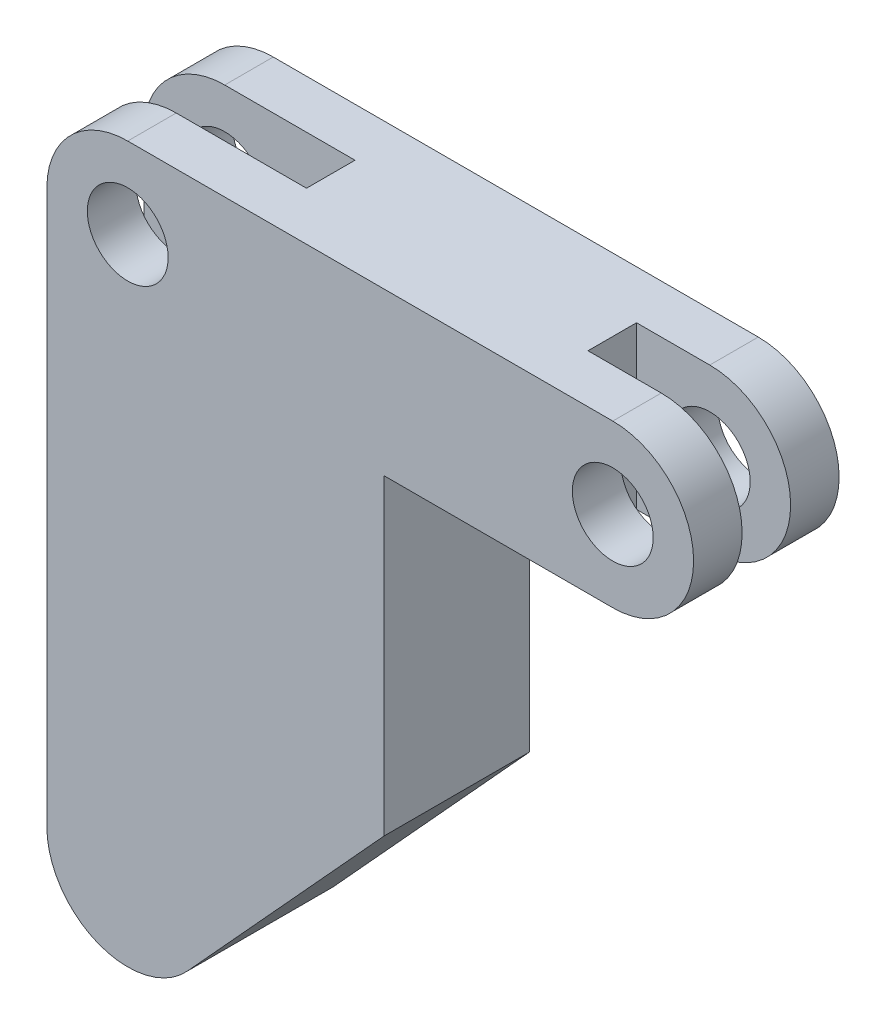
from build123d import *

# Parameters (mm, degrees)
SKETCH1_R           = 2.5
BOSS_EXTRUDE1_DEPTH = 4.5
CUT_EXTRUDE1_DEPTH  = 1.5
CUT_EXTRUDE2_DEPTH  = 1.5
CUT_EXTRUDE3_DEPTH  = 1.5


with BuildPart() as part:
    # Sketch1 → Boss-Extrude1 (new, symmetric)
    with BuildSketch(Plane.XY):
        with BuildLine():
            Line((15, 5), (-15, 5))
            ThreePointArc((-15, 5), (-18.535533906, 3.535533906), (-20, 0))
            Line((-20, 0), (-20, -34.242134344))
            ThreePointArc((-20, -34.242134344), (-16.808430712, -38.903633927), (-11.308168657, -37.614133948))
            Line((-11.308168657, -37.614133948), (0.85432415, -24.298037441))
            Line((0.85432415, -24.298037441), (0.85432415, -5))
            Line((0.85432415, -5), (15, -5))
            ThreePointArc((15, -5), (20, 0), (15, 5))
        make_face()
        with Locations((-15, 0)):
            Circle(SKETCH1_R, mode=Mode.SUBTRACT)
        with Locations((15, 0)):
            Circle(SKETCH1_R, mode=Mode.SUBTRACT)
    extrude(amount=BOSS_EXTRUDE1_DEPTH, both=True)

    # Sketch2 → Cut-Extrude1 (cut, symmetric)
    with BuildSketch(Plane.XY):
        Polygon((-15, 5), (-6.942314992, 5), (-6.942314992, -8.265165355), (-20, -8.265165355), (-20, 0), align=None)
    extrude(amount=CUT_EXTRUDE1_DEPTH, both=True, mode=Mode.SUBTRACT)

    # Sketch4 → Cut-Extrude2 (cut, symmetric)
    with BuildSketch(Plane.XY):
        with BuildLine():
            Line((-20, 0), (-15, 5))
            ThreePointArc((-15, 5), (-18.535533906, 3.535533906), (-20, 0))
        make_face()
    extrude(amount=CUT_EXTRUDE2_DEPTH, both=True, mode=Mode.SUBTRACT)

    # Sketch5 → Cut-Extrude3 (cut, symmetric)
    with BuildSketch(Plane.XY):
        with BuildLine():
            Line((10.468699528, 5), (10.468699528, -5))
            Line((10.468699528, -5), (15, -5))
            ThreePointArc((15, -5), (20, 0), (15, 5))
            Line((15, 5), (10.468699528, 5))
        make_face()
    extrude(amount=CUT_EXTRUDE3_DEPTH, both=True, mode=Mode.SUBTRACT)


solid = part.part
